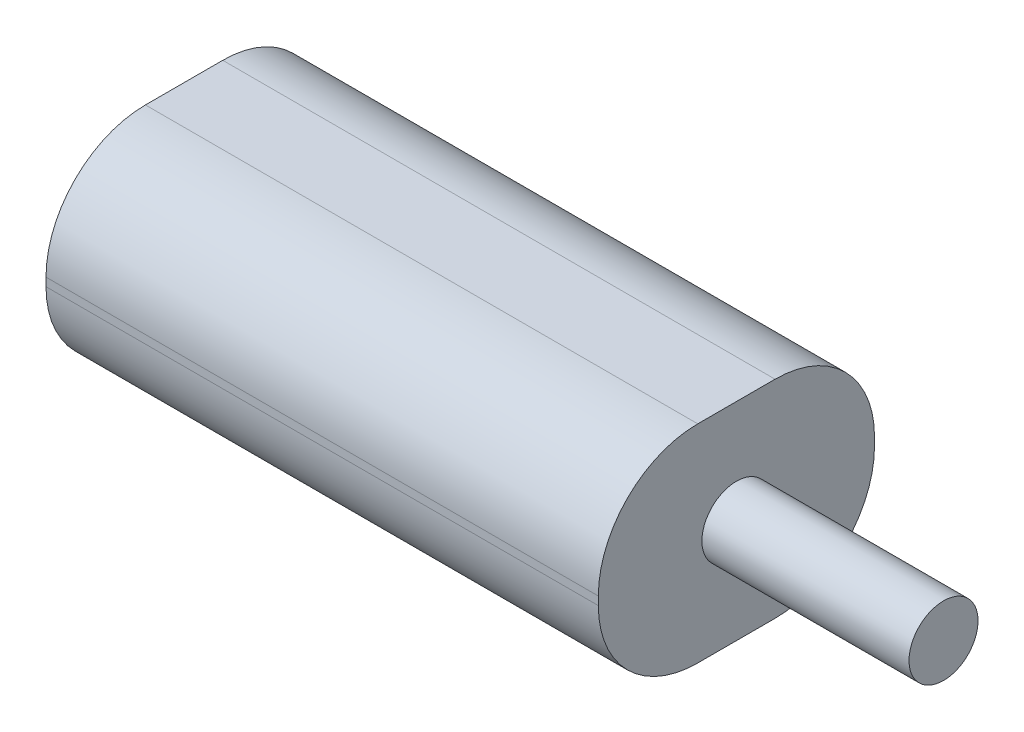
from build123d import *

# Parameters (mm, degrees)
SKETCH1_W           = 25.4
SKETCH1_H           = 12.7
BOSS_EXTRUDE1_DEPTH = 9.525
SKETCH2_R           = 1.5875
BOSS_EXTRUDE2_DEPTH = 9.525
FILLET1_R           = 4.572


with BuildPart() as part:
    # Sketch1 → Boss-Extrude1 (new body)
    with BuildSketch(Plane(origin=(0, 0, 0), x_dir=(1, 0, 0), z_dir=(0, 1, 0))):
        Rectangle(SKETCH1_W, SKETCH1_H)
    extrude(amount=BOSS_EXTRUDE1_DEPTH)

    # Sketch2 → Boss-Extrude2 (add)
    with BuildSketch(Plane(origin=(12.7, 0, 0), x_dir=(0, 0, -1), z_dir=(1, 0, 0))):
        with Locations(Location((0, 4.7625, 0), (0, 0, 180))):
            Circle(SKETCH2_R)
    extrude(amount=BOSS_EXTRUDE2_DEPTH)

    # Fillet1
    fillet1_edges = [part.edges().sort_by_distance(p)[0] for p in [
        (0, 9.525, -6.35),
        (0, 0, -6.35),
        (0, 0, 6.35),
        (0, 9.525, 6.35),
    ]]
    fillet(fillet1_edges, radius=FILLET1_R)


solid = part.part
